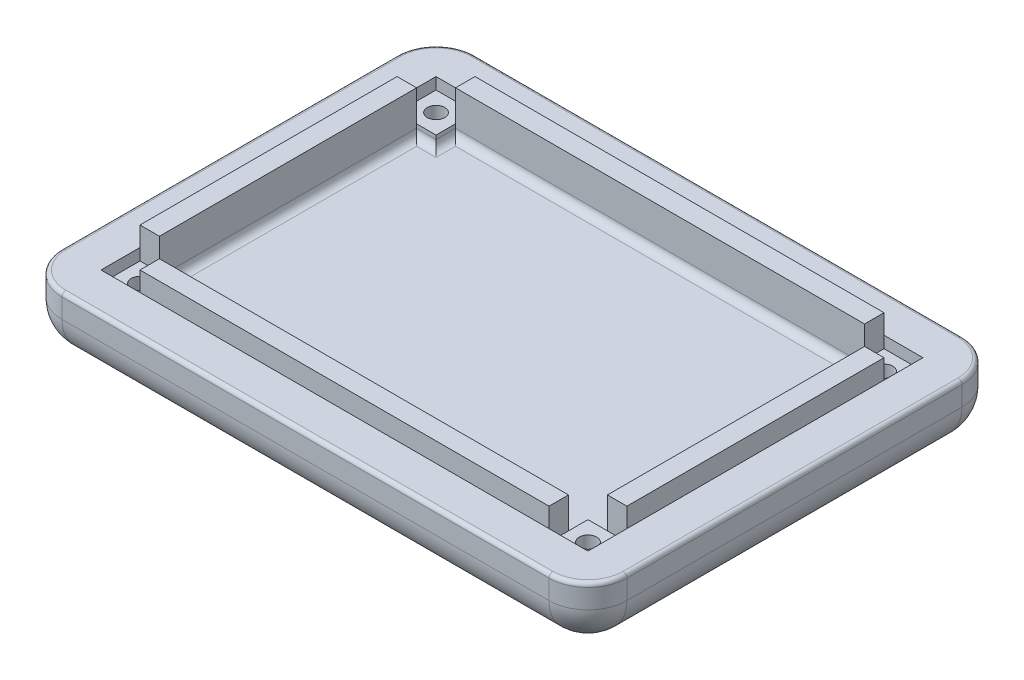
from build123d import *

# Parameters (mm, degrees)
SKETCH1_W                       = 145
SKETCH1_H                       = 106
BOSS_EXTRUDE1_DEPTH             = 16
CUT_EXTRUDE1_START              = 16
SKETCH1_4_W                     = 125
SKETCH1_4_H                     = 86
CUT_EXTRUDE1_DEPTH              = 6
SKETCH6_W                       = 10
SKETCH6_H                       = 10
BOSS_EXTRUDE5_DEPTH             = 3
MIRROR2_COPY_1_SKETCH_W         = 10
MIRROR2_COPY_1_SKETCH_H         = 10
MIRROR2_COPY_1_DEPTH            = 3
BOSS_EXTRUDE6_REACH             = 93.221
BOSS_EXTRUDE6_DIRECTION_2_REACH = 93.221
BOSS_EXTRUDE7_REACH             = 94.229
SKETCH9_W                       = 5
SKETCH9_H                       = 11
BOSS_EXTRUDE7_DIRECTION_2_REACH = 94.229
FILLET1_R                       = 10
FILLET3_R                       = 2
FILLET11_R                      = 1


with BuildPart() as part:
    # Sketch1 → Boss-Extrude1 (new body)
    with BuildSketch(Plane(origin=(0, 0, 0), x_dir=(1, 0, 0), z_dir=(0, 1, 0))):
        Rectangle(SKETCH1_W, SKETCH1_H)
    extrude(amount=BOSS_EXTRUDE1_DEPTH)

    # Sketch1<4> → Cut-Extrude1 (cut)
    with BuildSketch(Plane(origin=(0, 0, 0), x_dir=(1, 0, 0), z_dir=(0, 1, 0)).offset(CUT_EXTRUDE1_START)):
        Rectangle(SKETCH1_4_W, SKETCH1_4_H)
    extrude(amount=-CUT_EXTRUDE1_DEPTH, mode=Mode.SUBTRACT)

    # Sketch6 → Boss-Extrude5 (add)
    with BuildSketch(Plane(origin=(0, 10, 0), x_dir=(1, 0, 0), z_dir=(0, 1, 0))):
        with Locations((-57.5, 38)):
            Rectangle(SKETCH6_W, SKETCH6_H)
    boss_extrude5 = extrude(amount=BOSS_EXTRUDE5_DEPTH)

    # Sketch8 → M4 Clearance Hole1 (revolve, cut)
    with BuildSketch(Plane(origin=(-57.5, 13, -38), x_dir=(0, 0, 1), z_dir=(1, 0, 0))):
        Polygon((0, 0), (0, 7.25), (2.25, 5), (2.25, 0), align=None)
    m4_clearance_hole1 = revolve(axis=Axis((-57.5, 19.35, -38), (0, -1, 0)), mode=Mode.SUBTRACT)

    # Mirror1: Boss-Extrude5, M4 Clearance Hole1 across plane
    add(boss_extrude5.mirror(Plane(origin=(0, 0, 0), x_dir=(0, 0, 1), z_dir=(1, 0, 0))))
    add(m4_clearance_hole1.mirror(Plane(origin=(0, 0, 0), x_dir=(0, 0, 1), z_dir=(1, 0, 0))), mode=Mode.SUBTRACT)

    # Mirror2: Boss-Extrude5, M4 Clearance Hole1 across plane
    add(boss_extrude5.mirror(Plane.XY))
    add(m4_clearance_hole1.mirror(Plane.XY), mode=Mode.SUBTRACT)

    # Mirror2 copy 1 sketch → Mirror2 copy 1 (add)
    with BuildSketch(Plane(origin=(0, 10, 0), x_dir=(-1, 0, 0), z_dir=(0, 1, 0))):
        with Locations((-57.5, 38)):
            Rectangle(MIRROR2_COPY_1_SKETCH_W, MIRROR2_COPY_1_SKETCH_H)
    extrude(amount=MIRROR2_COPY_1_DEPTH)

    # Mirror2 copy 2 sketch → Mirror2 copy 2 (revolve, cut)
    with BuildSketch(Plane(origin=(57.5, 13, 38), x_dir=(0, 0, -1), z_dir=(-1, 0, 0))):
        Polygon((0, 0), (0, 7.25), (2.25, 5), (2.25, 0), align=None)
    revolve(axis=Axis((57.5, 19.35, 38), (0, -1, 0)), mode=Mode.SUBTRACT)

    # Boss-Extrude6: up to this face of the body (flat: up to its plane)
    boss_extrude6_end = Plane(part.part.faces().sort_by_distance((-57.5, 11.5, -33))[0])
    # Sketch4 → Boss-Extrude6 (add, up to the picked face)
    with BuildSketch(Plane.XY, mode=Mode.PRIVATE) as boss_extrude6_sk1:
        Polygon((-57.5, 10), (-57.5, 21), (-62.5, 21), (-62.5, 16), (-62.5, 10), align=None)
    boss_extrude6_tool1 = split(extrude(boss_extrude6_sk1.sketch, amount=-BOSS_EXTRUDE6_REACH, mode=Mode.PRIVATE), bisect_by=boss_extrude6_end, keep=Keep.BOTH, mode=Mode.PRIVATE)
    boss_extrude6 = boss_extrude6_tool1.solids().sort_by(Axis((-60, 15.5, 0), (0, 0, -1)))[0]
    add(boss_extrude6)

    # Boss-Extrude6 direction 2: up to this face of the body (flat: up to its plane)
    boss_extrude6_direction_2_end = Plane(part.part.faces().sort_by_distance((-57.5, 11.5, 33))[0])
    # Sketch4 → Boss-Extrude6 direction 2 (add, up to the picked face)
    with BuildSketch(Plane.XY, mode=Mode.PRIVATE) as boss_extrude6_direction_2_sk1:
        Polygon((-57.5, 10), (-57.5, 21), (-62.5, 21), (-62.5, 16), (-62.5, 10), align=None)
    boss_extrude6_direction_2_tool1 = split(extrude(boss_extrude6_direction_2_sk1.sketch, amount=BOSS_EXTRUDE6_DIRECTION_2_REACH, mode=Mode.PRIVATE), bisect_by=boss_extrude6_direction_2_end, keep=Keep.BOTH, mode=Mode.PRIVATE)
    boss_extrude6_direction_2 = boss_extrude6_direction_2_tool1.solids().sort_by(Axis((-60, 15.5, 0), (0, 0, 1)))[0]
    add(boss_extrude6_direction_2)

    # Boss-Extrude7: up to this face of the body (flat: up to its plane)
    boss_extrude7_end = Plane(part.part.faces().sort_by_distance((52.5, 11.5, 38))[0])
    # Sketch9 → Boss-Extrude7 (add, up to the picked face)
    with BuildSketch(Plane(origin=(0, 0, 0), x_dir=(0, 0, -1), z_dir=(1, 0, 0)), mode=Mode.PRIVATE) as boss_extrude7_sk1:
        with Locations((-40.5, 15.5)):
            Rectangle(SKETCH9_W, SKETCH9_H)
    boss_extrude7_tool1 = split(extrude(boss_extrude7_sk1.sketch, amount=BOSS_EXTRUDE7_REACH, mode=Mode.PRIVATE), bisect_by=boss_extrude7_end, keep=Keep.BOTH, mode=Mode.PRIVATE)
    boss_extrude7 = boss_extrude7_tool1.solids().sort_by(Axis((0, 15.5, 40.5), (1, 0, 0)))[0]
    add(boss_extrude7)

    # Boss-Extrude7 direction 2: up to this face of the body (flat: up to its plane)
    boss_extrude7_direction_2_end = Plane(part.part.faces().sort_by_distance((-52.5, 11.5, 38))[0])
    # Sketch9 → Boss-Extrude7 direction 2 (add, up to the picked face)
    with BuildSketch(Plane(origin=(0, 0, 0), x_dir=(0, 0, -1), z_dir=(1, 0, 0)), mode=Mode.PRIVATE) as boss_extrude7_direction_2_sk1:
        with Locations((-40.5, 15.5)):
            Rectangle(SKETCH9_W, SKETCH9_H)
    boss_extrude7_direction_2_tool1 = split(extrude(boss_extrude7_direction_2_sk1.sketch, amount=-BOSS_EXTRUDE7_DIRECTION_2_REACH, mode=Mode.PRIVATE), bisect_by=boss_extrude7_direction_2_end, keep=Keep.BOTH, mode=Mode.PRIVATE)
    boss_extrude7_direction_2 = boss_extrude7_direction_2_tool1.solids().sort_by(Axis((0, 15.5, 40.5), (-1, 0, 0)))[0]
    add(boss_extrude7_direction_2)

    # Mirror3: Boss-Extrude6, Boss-Extrude6 direction 2 across plane
    add(boss_extrude6.mirror(Plane(origin=(0, 0, 0), x_dir=(0, 0, 1), z_dir=(1, 0, 0))))
    add(boss_extrude6_direction_2.mirror(Plane(origin=(0, 0, 0), x_dir=(0, 0, 1), z_dir=(1, 0, 0))))

    # Mirror4: Boss-Extrude7, Boss-Extrude7 direction 2 across plane
    add(boss_extrude7.mirror(Plane.XY))
    add(boss_extrude7_direction_2.mirror(Plane.XY))

    # Fillet1
    fillet1_edges = [part.edges().sort_by_distance(p)[0] for p in [
        (0, 0, -53),
        (72.5, 0, 0),
        (0, 0, 53),
        (-72.5, 0, 0),
        (-72.5, 8, -53),
        (72.5, 8, -53),
        (72.5, 8, 53),
        (-72.5, 8, 53),
    ]]
    fillet(fillet1_edges, radius=FILLET1_R)

    # Fillet3
    fillet3_edges = [part.edges().sort_by_distance(p)[0] for p in [
        (-55, 10, 33),
        (-55, 10, -33),
        (-57.5, 10, 0),
        (0, 10, 38),
        (55, 10, 33),
        (55, 10, -33),
        (57.5, 10, 0),
        (0, 10, -38),
        (-52.5, 10, -35.5),
        (52.5, 10, -35.5),
        (52.5, 10, 35.5),
        (-52.5, 10, 35.5),
    ]]
    fillet(fillet3_edges, radius=FILLET3_R)

    # Fillet11
    fillet11_edges = [part.edges().sort_by_distance(p)[0] for p in [
        (0, 16, 53),
        (72.5, 16, 0),
        (0, 16, -53),
        (-72.5, 16, 0),
        (-69.571067812, 16, 50.071067812),
        (69.571067812, 16, 50.071067812),
        (69.571067812, 16, -50.071067812),
        (-69.571067812, 16, -50.071067812),
    ]]
    fillet(fillet11_edges, radius=FILLET11_R)


solid = part.part
